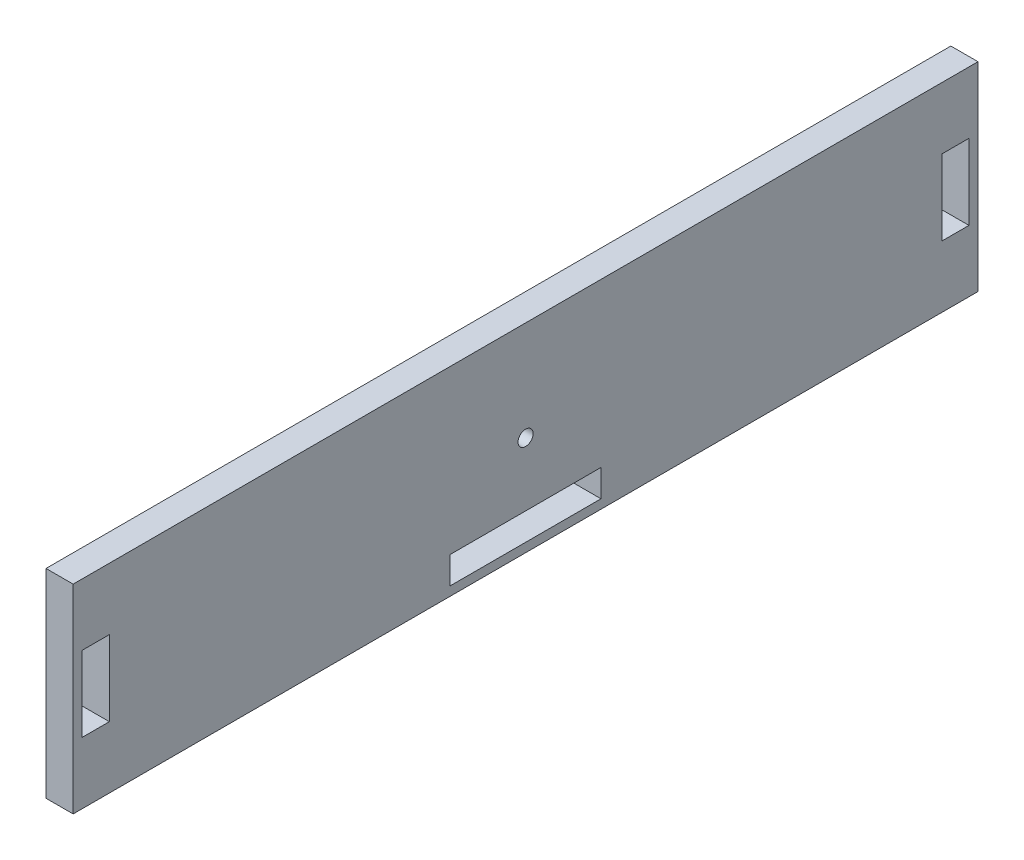
from build123d import *

# Parameters (mm, degrees)
SKETCH1_W           = 600
SKETCH1_H           = 132
BOSS_EXTRUDE1_DEPTH = 18
SKETCH3_R           = 5
CUT_EXTRUDE2_DEPTH  = 584
SKETCH4_W           = 18
SKETCH4_H           = 50
CUT_EXTRUDE4_DEPTH  = 615.612072774
SKETCH5_W           = 100
SKETCH5_H           = 18
CUT_EXTRUDE5_DEPTH  = 615.612072774


with BuildPart() as part:
    # Sketch1 → Boss-Extrude1 (new body)
    with BuildSketch(Plane(origin=(0, 0, 0), x_dir=(0, 0, -1), z_dir=(1, 0, 0))):
        with Locations((300, -66)):
            Rectangle(SKETCH1_W, SKETCH1_H)
    extrude(amount=BOSS_EXTRUDE1_DEPTH)

    # Sketch3 → Cut-Extrude2 (cut)
    with BuildSketch(Plane(origin=(18, 0, 0), x_dir=(0, 0, -1), z_dir=(1, 0, 0))):
        with Locations((300, -66)):
            Circle(SKETCH3_R)
    extrude(amount=-CUT_EXTRUDE2_DEPTH, mode=Mode.SUBTRACT)

    # Sketch4 → Cut-Extrude4 (cut, through all)
    with BuildSketch(Plane(origin=(18, 0, 0), x_dir=(0, 0, -1), z_dir=(1, 0, 0))):
        with Locations((585, -66)):
            Rectangle(SKETCH4_W, SKETCH4_H)
        with Locations((15, -66)):
            Rectangle(SKETCH4_W, SKETCH4_H)
    extrude(amount=-CUT_EXTRUDE4_DEPTH, mode=Mode.SUBTRACT)

    # Sketch5 → Cut-Extrude5 (cut, through all)
    with BuildSketch(Plane(origin=(18, 0, 0), x_dir=(0, 0, -1), z_dir=(1, 0, 0))):
        with Locations((300, -117)):
            Rectangle(SKETCH5_W, SKETCH5_H)
    extrude(amount=-CUT_EXTRUDE5_DEPTH, mode=Mode.SUBTRACT)


solid = part.part
